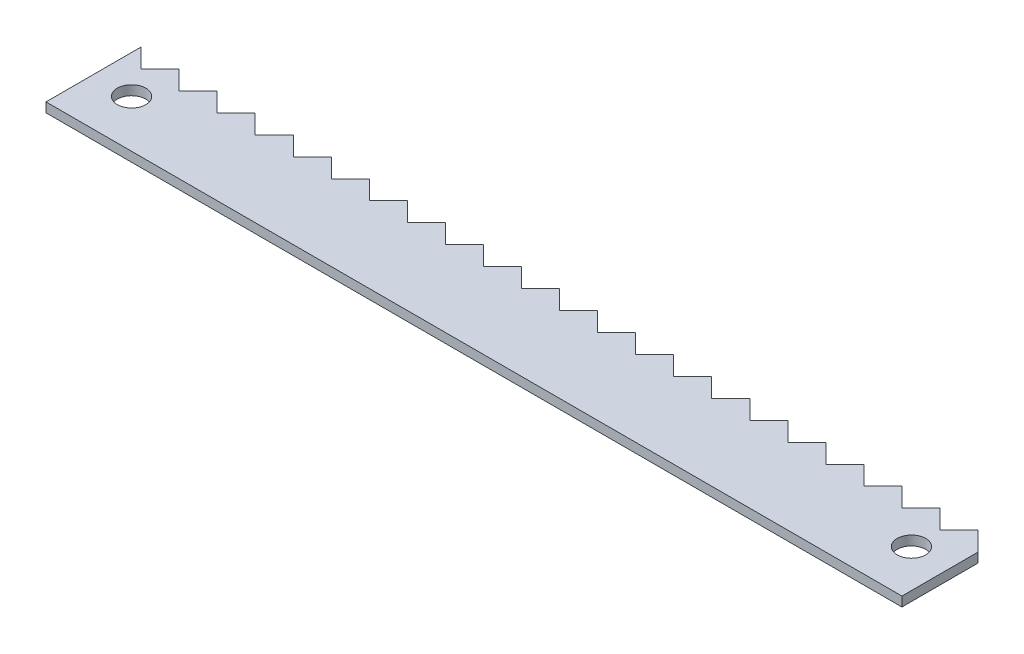
from build123d import *

# Parameters (mm, degrees)
SKETCH1_W           = 180
SKETCH1_H           = 2
BOSS_EXTRUDE1_DEPTH = 20
SKETCH2_R           = 3
CUT_EXTRUDE1_DEPTH  = 20
CUT_EXTRUDE2_DEPTH  = 20


with BuildPart() as part:
    # Sketch1 → Boss-Extrude1 (new body)
    with BuildSketch(Plane.XY):
        Rectangle(SKETCH1_W, SKETCH1_H)
    extrude(amount=BOSS_EXTRUDE1_DEPTH)

    # Sketch2 → Cut-Extrude1 (cut)
    with BuildSketch(Plane(origin=(0, 1, 0), x_dir=(1, 0, 0), z_dir=(0, 1, 0))):
        with Locations(Location((82, -10, 0), (0, 0, 270))):
            Circle(SKETCH2_R)
        with Locations(Location((-82, -10, 0), (0, 0, 180))):
            Circle(SKETCH2_R)
    extrude(amount=-CUT_EXTRUDE1_DEPTH, mode=Mode.SUBTRACT)

    # Sketch3 → Cut-Extrude2 (cut)
    with BuildSketch(Plane(origin=(0, 1, 0), x_dir=(1, 0, 0), z_dir=(0, 1, 0))):
        Polygon((-14, -4), (-10, 0), (-18, 0), align=None)
        Polygon((-22, -4), (-18, 0), (-26, 0), align=None)
        Polygon((82, -4), (86, 0), (78, 0), align=None)
        Polygon((86, 0), (90, -4), (90, 0), align=None)
        Polygon((74, -4), (78, 0), (70, 0), align=None)
        Polygon((66, -4), (70, 0), (62, 0), align=None)
        Polygon((58, -4), (62, 0), (54, 0), align=None)
        Polygon((50, -4), (54, 0), (46, 0), align=None)
        Polygon((42, -4), (46, 0), (38, 0), align=None)
        Polygon((34, -4), (38, 0), (30, 0), align=None)
        Polygon((26, -4), (30, 0), (22, 0), align=None)
        Polygon((18, -4), (22, 0), (14, 0), align=None)
        Polygon((10, -4), (14, 0), (6, 0), align=None)
        Polygon((2, -4), (6, 0), (-2, 0), align=None)
        Polygon((-30, -4), (-26, 0), (-34, 0), align=None)
        Polygon((-6, -4), (-2, 0), (-10, 0), align=None)
        Polygon((-38, -4), (-34, 0), (-42, 0), align=None)
        Polygon((-86, -4), (-82, 0), (-90, 0), align=None)
        Polygon((-78, -4), (-74, 0), (-82, 0), align=None)
        Polygon((-70, -4), (-66, 0), (-74, 0), align=None)
        Polygon((-62, -4), (-58, 0), (-66, 0), align=None)
        Polygon((-54, -4), (-50, 0), (-58, 0), align=None)
        Polygon((-46, -4), (-42, 0), (-50, 0), align=None)
    extrude(amount=-CUT_EXTRUDE2_DEPTH, mode=Mode.SUBTRACT)


solid = part.part
